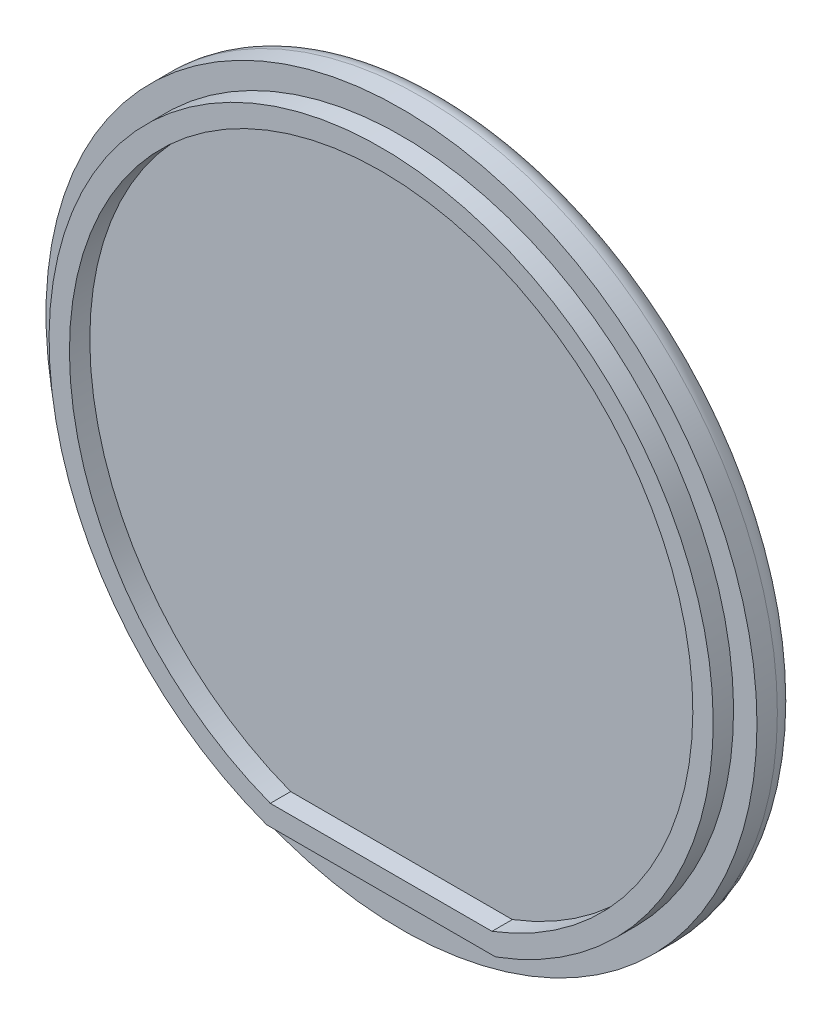
from build123d import *

# Parameters (mm, degrees)
ESQUISSE1_R             = 34.9
BOSS_EXTRU_1_DEPTH      = 4
ESQUISSE4_W             = 3
ESQUISSE4_H             = 15
BOSS_EXTRU_3_DEPTH      = 20
ENL_V_MAT_EXTRU_2_DEPTH = 57.306038753
CONG_1_R                = 5
ESQUISSE6_R             = 2.5
ENL_V_MAT_EXTRU_3_DEPTH = 55.995032503
BOSS_EXTRU_4_DEPTH      = 2
CONG_2_R                = 2


with BuildPart() as part:
    # Esquisse1 → Boss.-Extru.1 (new body)
    with BuildSketch(Plane.XY):
        Circle(ESQUISSE1_R)
    extrude(amount=BOSS_EXTRU_1_DEPTH)

    # Esquisse4 → Boss.-Extru.3 (add)
    with BuildSketch(Plane(origin=(0, 0, 0), x_dir=(-1, 0, 0), z_dir=(0, 0, -1))):
        with Locations((3, 0)):
            Rectangle(ESQUISSE4_W, ESQUISSE4_H)
        with Locations((-3, 0)):
            Rectangle(ESQUISSE4_W, ESQUISSE4_H)
    extrude(amount=BOSS_EXTRU_3_DEPTH)

    # Esquisse5 → Enlèv. mat.-Extru.2 (cut, through all)
    with BuildSketch(Plane(origin=(4.5, 0, 0), x_dir=(0, 0, -1), z_dir=(1, 0, 0))):
        with BuildLine():
            Line((8.44, 7.5), (20, 7.5))
            Line((20, 7.5), (20, -7.5))
            Line((20, -7.5), (8.44, -7.5))
            ThreePointArc((8.44, -7.5), (15.94, 0), (8.44, 7.5))
        make_face()
    extrude(amount=-ENL_V_MAT_EXTRU_2_DEPTH, mode=Mode.SUBTRACT)

    # Congé1
    cong_1_edges = [part.edges().sort_by_distance(p)[0] for p in [
        (-3, 7.5, 0),
        (-3, -7.5, 0),
        (-4.5, 0, 0),
        (4.5, 0, 0),
        (3, -7.5, 0),
        (3, 7.5, 0),
    ]]
    fillet(cong_1_edges, radius=CONG_1_R)

    # Esquisse6 → Enlèv. mat.-Extru.3 (cut, through all)
    with BuildSketch(Plane(origin=(4.5, 0, 0), x_dir=(0, 0, -1), z_dir=(1, 0, 0))):
        with Locations((8.44, 0)):
            Circle(ESQUISSE6_R)
    extrude(amount=-ENL_V_MAT_EXTRU_3_DEPTH, mode=Mode.SUBTRACT)

    # Esquisse2 → Boss.-Extru.4 (add)
    with BuildSketch(Plane.XY.offset(4)):
        with BuildLine():
            ThreePointArc((-11.241763565, -30.600371762), (0, 32.6), (11.241763565, -30.600371762))
            Line((11.241763565, -30.600371762), (-11.241763565, -30.600371762))
        make_face()
        with BuildLine():
            Line((-10.880199222, -28.600371762), (10.880199222, -28.600371762))
            ThreePointArc((10.880199222, -28.600371762), (0, 30.6), (-10.880199222, -28.600371762))
        make_face(mode=Mode.SUBTRACT)
    extrude(amount=BOSS_EXTRU_4_DEPTH)

    # Congé2
    cong_2_edges = [part.edges().sort_by_distance(p)[0] for p in [
        (-34.9, 0, 0),
    ]]
    fillet(cong_2_edges, radius=CONG_2_R)


solid = part.part
